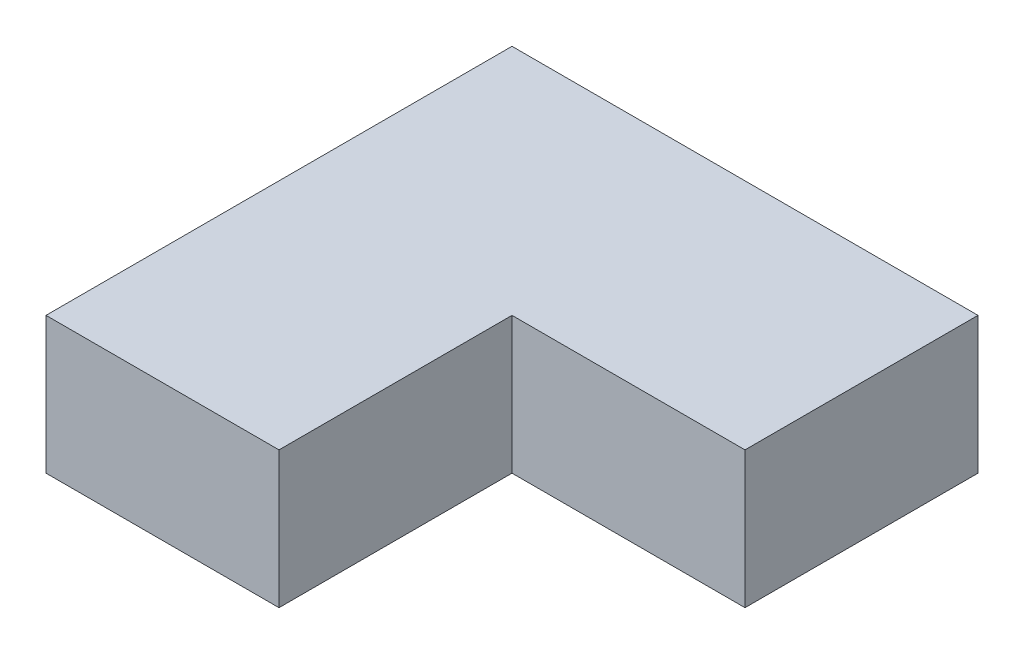
from build123d import *

# Parameters (mm, degrees)
SKETCH1_W           = 75
SKETCH1_H           = 75
BOSS_EXTRUDE1_DEPTH = 22
SKETCH2_W           = 37.5
SKETCH2_H           = 37.5
CUT_EXTRUDE1_DEPTH  = 58.415154794


with BuildPart() as part:
    # Sketch1 → Boss-Extrude1 (new body)
    with BuildSketch(Plane(origin=(0, 0, 0), x_dir=(1, 0, 0), z_dir=(0, 1, 0))):
        Rectangle(SKETCH1_W, SKETCH1_H)
    extrude(amount=BOSS_EXTRUDE1_DEPTH)

    # Sketch2 → Cut-Extrude1 (cut, through all)
    with BuildSketch(Plane(origin=(0, 22, 0), x_dir=(1, 0, 0), z_dir=(0, 1, 0))):
        with Locations((18.75, -18.75)):
            Rectangle(SKETCH2_W, SKETCH2_H)
    extrude(amount=-CUT_EXTRUDE1_DEPTH, mode=Mode.SUBTRACT)


solid = part.part
